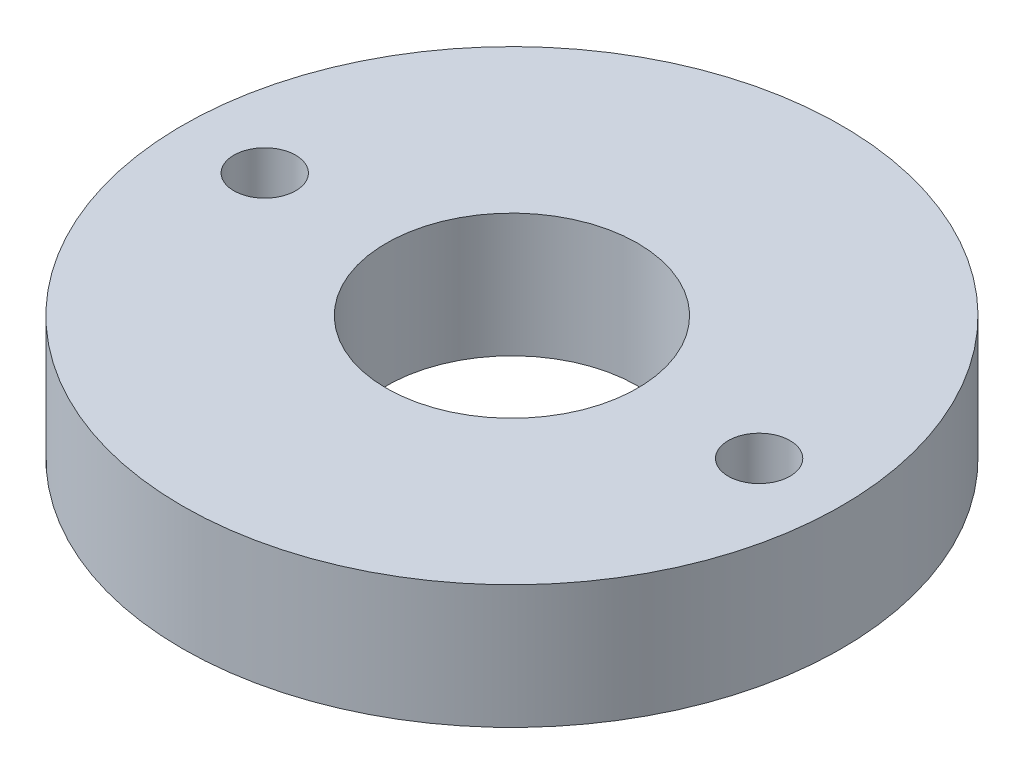
from build123d import *

# Parameters (mm, degrees)
SKETCH_1_R      = 16
SKETCH_1_R_2    = 6.1
SKETCH_1_R_3    = 1.5
EXTRUDE_1_DEPTH = 6


with BuildPart() as part:
    # ｽｹｯﾁ1 → ﾎﾞｽ - 押し出し1 (new body)
    with BuildSketch(Plane(origin=(0, 0, 0), x_dir=(1, 0, 0), z_dir=(0, 1, 0))):
        with Locations(Location((0, 0, 0), (0, 0, 270))):
            Circle(SKETCH_1_R)
        with Locations(Location((0, 0, 0), (0, 0, 270))):
            Circle(SKETCH_1_R_2, mode=Mode.SUBTRACT)
        with Locations(Location((12, 0, 0), (0, 0, 270))):
            Circle(SKETCH_1_R_3, mode=Mode.SUBTRACT)
        with Locations(Location((-12, 0, 0), (0, 0, 90))):
            Circle(SKETCH_1_R_3, mode=Mode.SUBTRACT)
    extrude(amount=EXTRUDE_1_DEPTH)


solid = part.part
